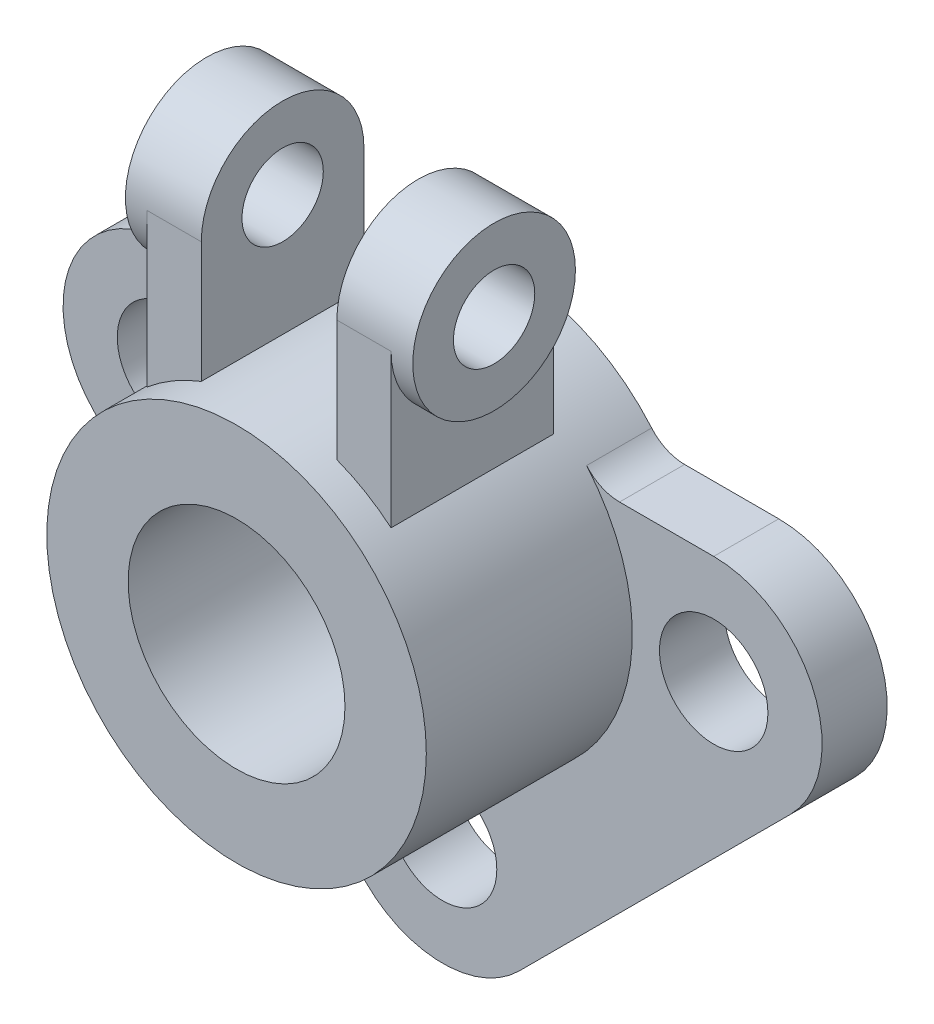
from build123d import *

# Parameters (mm, degrees)
SKETCH1_R           = 10
BOSS_EXTRUDE1_DEPTH = 12
SKETCH1_3_R         = 35
SKETCH1_3_R_2       = 20
BOSS_EXTRUDE2_DEPTH = 50
FILLET1_R           = 8
BOSS_EXTRUDE3_START = -36
BOSS_EXTRUDE3_DEPTH = 30
SKETCH3_R           = 7.5
CUT_EXTRUDE1_DEPTH  = 127.318050967
BOSS_EXTRUDE4_START = 4
SKETCH3_3_R         = 15
SKETCH3_3_R_2       = 7.5
BOSS_EXTRUDE4_DEPTH = 4


with BuildPart() as part:
    # Sketch1 → Boss-Extrude1 (new body)
    with BuildSketch(Plane.XY):
        with BuildLine():
            Line((50, 20), (28.722813233, 20))
            ThreePointArc((28.722813233, 20), (0, -35), (-28.722813233, 20))
            Line((-28.722813233, 20), (-50, 20))
            ThreePointArc((-50, 20), (-68.47759065, 7.653668647), (-64.142135624, -14.142135624))
            Line((-64.142135624, -14.142135624), (-14.142135624, -64.142135624))
            ThreePointArc((-14.142135624, -64.142135624), (0, -70), (14.142135624, -64.142135624))
            Line((14.142135624, -64.142135624), (64.142135624, -14.142135624))
            ThreePointArc((64.142135624, -14.142135624), (68.47759065, 7.653668647), (50, 20))
        make_face()
        with Locations((0, -50)):
            Circle(SKETCH1_R, mode=Mode.SUBTRACT)
        with Locations((50, 0)):
            Circle(SKETCH1_R, mode=Mode.SUBTRACT)
        with Locations((-50, 0)):
            Circle(SKETCH1_R, mode=Mode.SUBTRACT)
    extrude(amount=BOSS_EXTRUDE1_DEPTH)

    # Sketch1<3> → Boss-Extrude2 (add)
    with BuildSketch(Plane.XY):
        Circle(SKETCH1_3_R)
        Circle(SKETCH1_3_R_2, mode=Mode.SUBTRACT)
    extrude(amount=BOSS_EXTRUDE2_DEPTH)

    # Fillet1
    fillet1_edges = [part.edges().sort_by_distance(p)[0] for p in [
        (-28.722813233, 20, 6),
        (28.722813233, 20, 6),
    ]]
    fillet(fillet1_edges, radius=FILLET1_R)

    # Sketch2 → Boss-Extrude3 (add)
    with BuildSketch(Plane.XY.offset(50).offset(BOSS_EXTRUDE3_START)):
        with BuildLine():
            Line((12.5, 70), (12.5, 32.691742077))
            ThreePointArc((12.5, 32.691742077), (17.745426285, 30.167861143), (22.5, 26.809513237))
            Line((22.5, 26.809513237), (22.5, 70))
            Line((22.5, 70), (12.5, 70))
        make_face()
        with BuildLine():
            ThreePointArc((-22.5, 26.809513237), (-17.745426285, 30.167861143), (-12.5, 32.691742077))
            Line((-12.5, 32.691742077), (-12.5, 70))
            Line((-12.5, 70), (-22.5, 70))
            Line((-22.5, 70), (-22.5, 26.809513237))
        make_face()
    extrude(amount=BOSS_EXTRUDE3_DEPTH)

    # Sketch3 → Cut-Extrude1 (cut, through all)
    with BuildSketch(Plane(origin=(22.5, 0, 0), x_dir=(0, 0, -1), z_dir=(1, 0, 0))):
        with BuildLine():
            ThreePointArc((-29, 70), (-18.393398282, 65.606601718), (-14, 55))
            Line((-14, 55), (-14, 70))
            Line((-14, 70), (-29, 70))
        make_face()
        with BuildLine():
            ThreePointArc((-44, 55), (-39.606601718, 65.606601718), (-29, 70))
            Line((-29, 70), (-44, 70))
            Line((-44, 70), (-44, 55))
        make_face()
        with Locations((-29, 55)):
            Circle(SKETCH3_R)
    extrude(amount=-CUT_EXTRUDE1_DEPTH, mode=Mode.SUBTRACT)

    # Sketch3<3> → Boss-Extrude4 (add)
    with BuildSketch(Plane(origin=(22.5, 0, 0), x_dir=(0, 0, -1), z_dir=(1, 0, 0)).offset(BOSS_EXTRUDE4_START)):
        with Locations((-29, 55)):
            Circle(SKETCH3_3_R)
        with Locations((-29, 55)):
            Circle(SKETCH3_3_R_2, mode=Mode.SUBTRACT)
    boss_extrude4 = extrude(amount=-BOSS_EXTRUDE4_DEPTH)

    # Mirror1: Boss-Extrude4 across plane
    add(boss_extrude4.mirror(Plane(origin=(0, 0, 0), x_dir=(0, 0, 1), z_dir=(1, 0, 0))))


solid = part.part
